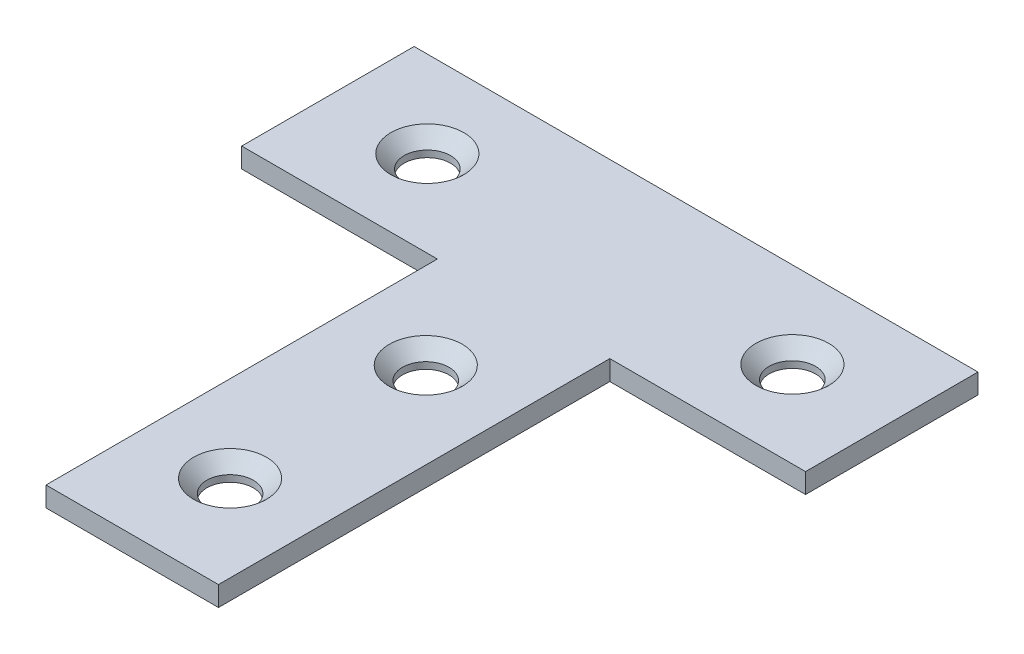
from build123d import *

# Parameters (mm, degrees)
BOSS_EXTRUDE1_DEPTH     = 1.5
CUT_EXTRUDE1_DEPTH      = 33.580828274
CUT_EXTRUDE1_DEPTH_BACK = 33.580828274
SKETCH2_R               = 1.75
CHAMFER2_SIZE           = 1
CHAMFER4_SIZE           = 1


with BuildPart() as part:
    # Sketch1 → Boss-Extrude1 (new body)
    with BuildSketch(Plane(origin=(0, 0, 0), x_dir=(1, 0, 0), z_dir=(0, 1, 0))):
        Polygon((21.25, 17.848471223), (-21.25, 17.848471223), (-21.25, 4.848471223), (-6.5, 4.848471223), (-6.5, -24.651528777), (6.5, -24.651528777), (6.5, 4.848471223), (21.25, 4.848471223), align=None)
    extrude(amount=BOSS_EXTRUDE1_DEPTH)

    # Sketch2 → Cut-Extrude1 (cut, two sides: drawn at the far end of the back side and taken through both)
    with BuildSketch(Plane(origin=(0, 1.5, 0), x_dir=(1, 0, 0), z_dir=(0, 1, 0)).offset(-CUT_EXTRUDE1_DEPTH_BACK)):
        with Locations(Location((-13.756799801, 11.348471223, 0), (0, 0, 270))):
            Circle(SKETCH2_R)
        with Locations(Location((13.756799801, 11.348471223, 0), (0, 0, 90))):
            Circle(SKETCH2_R)
        with Locations(Location((0, -2.526528777, 0), (0, 0, 270))):
            Circle(SKETCH2_R)
        with Locations(Location((0, -17.276528777, 0), (0, 0, 90))):
            Circle(SKETCH2_R)
    extrude(amount=CUT_EXTRUDE1_DEPTH + CUT_EXTRUDE1_DEPTH_BACK, mode=Mode.SUBTRACT)

    # Chamfer2
    chamfer2_edges = [part.edges().sort_by_distance(p)[0] for p in [
        (-13.756799801, 1.5, -13.098471223),
    ]]
    chamfer(chamfer2_edges, length=CHAMFER2_SIZE)

    # Chamfer4
    chamfer4_edges = [part.edges().sort_by_distance(p)[0] for p in [
        (13.756799801, 1.5, -9.598471223),
        (0, 1.5, 19.026528777),
        (0, 1.5, 0.776528777),
    ]]
    chamfer(chamfer4_edges, length=CHAMFER4_SIZE)


solid = part.part
